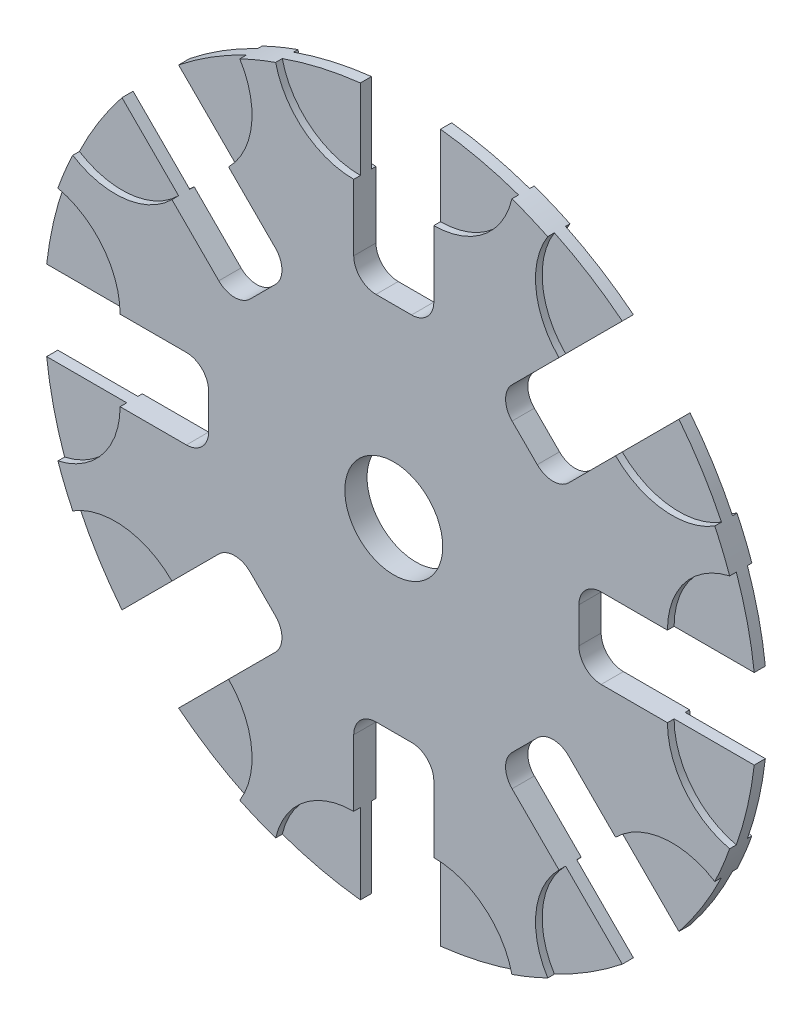
from build123d import *

# Parameters (mm, degrees)
SKETCH1_R           = 11
BOSS_EXTRUDE1_DEPTH = 5
BOSS_EXTRUDE2_START = -4
BOSS_EXTRUDE2_DEPTH = 2.5


with BuildPart() as part:
    # Sketch1 → Boss-Extrude1 (new body)
    with BuildSketch(Plane.XY):
        with BuildLine():
            ThreePointArc((4, -41.6), (7.535533906, -43.064466094), (9, -46.6))
            Line((9, -46.6), (9, -61.492137976))
            ThreePointArc((9, -61.492137976), (20.215230476, -65.413125036), (26.544375, -75.467848491))
            ThreePointArc((26.544375, -75.467848491), (30.614674589, -73.910362601), (34.594119865, -72.133534994))
            ThreePointArc((34.594119865, -72.133534994), (31.959737739, -60.548390845), (37.117546722, -49.845468783))
            Line((37.117546722, -49.845468783), (26.587214973, -39.315137034))
            ThreePointArc((26.587214973, -39.315137034), (25.122748879, -35.779603128), (26.587214973, -32.244069222))
            Line((26.587214973, -32.244069222), (32.244069222, -26.587214973))
            ThreePointArc((32.244069222, -26.587214973), (35.779603128, -25.122748879), (39.315137034, -26.587214973))
            Line((39.315137034, -26.587214973), (49.845468783, -37.117546722))
            ThreePointArc((49.845468783, -37.117546722), (60.548390845, -31.959737739), (72.133534994, -34.594119865))
            ThreePointArc((72.133534994, -34.594119865), (73.910362601, -30.614674589), (75.467848491, -26.544375))
            ThreePointArc((75.467848491, -26.544375), (65.413125036, -20.215230476), (61.492137976, -9))
            Line((61.492137976, -9), (46.6, -9))
            ThreePointArc((46.6, -9), (43.064466094, -7.535533906), (41.6, -4))
            Line((41.6, -4), (41.6, 4))
            ThreePointArc((41.6, 4), (43.064466094, 7.535533906), (46.6, 9))
            Line((46.6, 9), (61.492137976, 9))
            ThreePointArc((61.492137976, 9), (65.413125036, 20.215230476), (75.467848491, 26.544375))
            ThreePointArc((75.467848491, 26.544375), (73.910362601, 30.614674589), (72.133534994, 34.594119865))
            ThreePointArc((72.133534994, 34.594119865), (60.548390845, 31.959737739), (49.845468783, 37.117546722))
            Line((49.845468783, 37.117546722), (39.315137034, 26.587214973))
            ThreePointArc((39.315137034, 26.587214973), (35.779603128, 25.122748879), (32.244069222, 26.587214973))
            Line((32.244069222, 26.587214973), (26.587214973, 32.244069222))
            ThreePointArc((26.587214973, 32.244069222), (25.122748879, 35.779603128), (26.587214973, 39.315137034))
            Line((26.587214973, 39.315137034), (37.117546722, 49.845468783))
            ThreePointArc((37.117546722, 49.845468783), (31.959737739, 60.548390845), (34.594119865, 72.133534994))
            ThreePointArc((34.594119865, 72.133534994), (30.614674589, 73.910362601), (26.544375, 75.467848491))
            ThreePointArc((26.544375, 75.467848491), (20.215230476, 65.413125036), (9, 61.492137976))
            Line((9, 61.492137976), (9, 46.6))
            ThreePointArc((9, 46.6), (7.535533906, 43.064466094), (4, 41.6))
            Line((4, 41.6), (-4, 41.6))
            ThreePointArc((-4, 41.6), (-7.535533906, 43.064466094), (-9, 46.6))
            Line((-9, 46.6), (-9, 61.492137976))
            ThreePointArc((-9, 61.492137976), (-20.215230476, 65.413125036), (-26.544375, 75.467848491))
            ThreePointArc((-26.544375, 75.467848491), (-30.614674589, 73.910362601), (-34.594119865, 72.133534994))
            ThreePointArc((-34.594119865, 72.133534994), (-31.959737739, 60.548390845), (-37.117546722, 49.845468783))
            Line((-37.117546722, 49.845468783), (-26.587214973, 39.315137034))
            ThreePointArc((-26.587214973, 39.315137034), (-25.122748879, 35.779603128), (-26.587214973, 32.244069222))
            Line((-26.587214973, 32.244069222), (-32.244069222, 26.587214973))
            ThreePointArc((-32.244069222, 26.587214973), (-35.779603128, 25.122748879), (-39.315137034, 26.587214973))
            Line((-39.315137034, 26.587214973), (-49.845468783, 37.117546722))
            ThreePointArc((-49.845468783, 37.117546722), (-60.548390845, 31.959737739), (-72.133534994, 34.594119865))
            ThreePointArc((-72.133534994, 34.594119865), (-73.910362601, 30.614674589), (-75.467848491, 26.544375))
            ThreePointArc((-75.467848491, 26.544375), (-65.413125036, 20.215230476), (-61.492137976, 9))
            Line((-61.492137976, 9), (-46.6, 9))
            ThreePointArc((-46.6, 9), (-43.064466094, 7.535533906), (-41.6, 4))
            Line((-41.6, 4), (-41.6, -4))
            ThreePointArc((-41.6, -4), (-43.064466094, -7.535533906), (-46.6, -9))
            Line((-46.6, -9), (-61.492137976, -9))
            ThreePointArc((-61.492137976, -9), (-65.413125036, -20.215230476), (-75.467848491, -26.544375))
            ThreePointArc((-75.467848491, -26.544375), (-73.910362601, -30.614674589), (-72.133534994, -34.594119865))
            ThreePointArc((-72.133534994, -34.594119865), (-60.548390845, -31.959737739), (-49.845468783, -37.117546722))
            Line((-49.845468783, -37.117546722), (-39.315137034, -26.587214973))
            ThreePointArc((-39.315137034, -26.587214973), (-35.779603128, -25.122748879), (-32.244069222, -26.587214973))
            Line((-32.244069222, -26.587214973), (-26.587214973, -32.244069222))
            ThreePointArc((-26.587214973, -32.244069222), (-25.122748879, -35.779603128), (-26.587214973, -39.315137034))
            Line((-26.587214973, -39.315137034), (-37.117546722, -49.845468783))
            ThreePointArc((-37.117546722, -49.845468783), (-31.959737739, -60.548390845), (-34.594119865, -72.133534994))
            ThreePointArc((-34.594119865, -72.133534994), (-30.614674589, -73.910362601), (-26.544375, -75.467848491))
            ThreePointArc((-26.544375, -75.467848491), (-20.215230476, -65.413125036), (-9, -61.492137976))
            Line((-9, -61.492137976), (-9, -46.6))
            ThreePointArc((-9, -46.6), (-7.535533906, -43.064466094), (-4, -41.6))
            Line((-4, -41.6), (4, -41.6))
        make_face()
        Circle(SKETCH1_R, mode=Mode.SUBTRACT)
    extrude(amount=BOSS_EXTRUDE1_DEPTH)

    # Sketch2 → Boss-Extrude2 (add)
    with BuildSketch(Plane.XY.offset(5).offset(BOSS_EXTRUDE2_START)):
        with BuildLine():
            ThreePointArc((-37.117546722, 49.845468783), (-31.959737739, 60.548390845), (-34.594119865, 72.133534994))
            ThreePointArc((-34.594119865, 72.133534994), (-42.489529555, 67.783772971), (-49.845468783, 62.573390845))
            Line((-49.845468783, 62.573390845), (-37.117546722, 49.845468783))
        make_face()
        with BuildLine():
            Line((-49.845468783, 37.117546722), (-62.573390845, 49.845468783))
            ThreePointArc((-62.573390845, 49.845468783), (-67.783772971, 42.489529555), (-72.133534994, 34.594119865))
            ThreePointArc((-72.133534994, 34.594119865), (-60.548390845, 31.959737739), (-49.845468783, 37.117546722))
        make_face()
        with BuildLine():
            Line((-9, 61.492137976), (-9, 79.492137976))
            ThreePointArc((-9, 79.492137976), (-17.885731045, 77.975), (-26.544375, 75.467848491))
            ThreePointArc((-26.544375, 75.467848491), (-20.215230476, 65.413125036), (-9, 61.492137976))
        make_face()
        with BuildLine():
            ThreePointArc((9, 61.492137976), (20.215230476, 65.413125036), (26.544375, 75.467848491))
            ThreePointArc((26.544375, 75.467848491), (17.885731045, 77.975), (9, 79.492137976))
            Line((9, 79.492137976), (9, 61.492137976))
        make_face()
        with BuildLine():
            Line((37.117546722, 49.845468783), (49.845468783, 62.573390845))
            ThreePointArc((49.845468783, 62.573390845), (42.489529555, 67.783772971), (34.594119865, 72.133534994))
            ThreePointArc((34.594119865, 72.133534994), (31.959737739, 60.548390845), (37.117546722, 49.845468783))
        make_face()
        with BuildLine():
            ThreePointArc((49.845468783, 37.117546722), (60.548390845, 31.959737739), (72.133534994, 34.594119865))
            ThreePointArc((72.133534994, 34.594119865), (67.783772971, 42.489529555), (62.573390845, 49.845468783))
            Line((62.573390845, 49.845468783), (49.845468783, 37.117546722))
        make_face()
        with BuildLine():
            Line((61.492137976, 9), (79.492137976, 9))
            ThreePointArc((79.492137976, 9), (77.975, 17.885731045), (75.467848491, 26.544375))
            ThreePointArc((75.467848491, 26.544375), (65.413125036, 20.215230476), (61.492137976, 9))
        make_face()
        with BuildLine():
            Line((79.492137976, -9), (61.492137976, -9))
            ThreePointArc((61.492137976, -9), (65.413125036, -20.215230476), (75.467848491, -26.544375))
            ThreePointArc((75.467848491, -26.544375), (77.975, -17.885731045), (79.492137976, -9))
        make_face()
        with BuildLine():
            ThreePointArc((62.573390845, -49.845468783), (67.783772971, -42.489529555), (72.133534994, -34.594119865))
            ThreePointArc((72.133534994, -34.594119865), (60.548390845, -31.959737739), (49.845468783, -37.117546722))
            Line((49.845468783, -37.117546722), (62.573390845, -49.845468783))
        make_face()
        with BuildLine():
            ThreePointArc((34.594119865, -72.133534994), (42.489529555, -67.783772971), (49.845468783, -62.573390845))
            Line((49.845468783, -62.573390845), (37.117546722, -49.845468783))
            ThreePointArc((37.117546722, -49.845468783), (31.959737739, -60.548390845), (34.594119865, -72.133534994))
        make_face()
        with BuildLine():
            ThreePointArc((9, -79.492137976), (17.885731045, -77.975), (26.544375, -75.467848491))
            ThreePointArc((26.544375, -75.467848491), (20.215230476, -65.413125036), (9, -61.492137976))
            Line((9, -61.492137976), (9, -79.492137976))
        make_face()
        with BuildLine():
            ThreePointArc((-26.544375, -75.467848491), (-17.885731045, -77.975), (-9, -79.492137976))
            Line((-9, -79.492137976), (-9, -61.492137976))
            ThreePointArc((-9, -61.492137976), (-20.215230476, -65.413125036), (-26.544375, -75.467848491))
        make_face()
        with BuildLine():
            ThreePointArc((-49.845468783, -62.573390845), (-42.489529555, -67.783772971), (-34.594119865, -72.133534994))
            ThreePointArc((-34.594119865, -72.133534994), (-31.959737739, -60.548390845), (-37.117546722, -49.845468783))
            Line((-37.117546722, -49.845468783), (-49.845468783, -62.573390845))
        make_face()
        with BuildLine():
            ThreePointArc((-72.133534994, -34.594119865), (-67.783772971, -42.489529555), (-62.573390845, -49.845468783))
            Line((-62.573390845, -49.845468783), (-49.845468783, -37.117546722))
            ThreePointArc((-49.845468783, -37.117546722), (-60.548390845, -31.959737739), (-72.133534994, -34.594119865))
        make_face()
        with BuildLine():
            ThreePointArc((-79.492137976, -9), (-77.975, -17.885731045), (-75.467848491, -26.544375))
            ThreePointArc((-75.467848491, -26.544375), (-65.413125036, -20.215230476), (-61.492137976, -9))
            Line((-61.492137976, -9), (-79.492137976, -9))
        make_face()
        with BuildLine():
            ThreePointArc((-75.467848491, 26.544375), (-77.975, 17.885731045), (-79.492137976, 9))
            Line((-79.492137976, 9), (-61.492137976, 9))
            ThreePointArc((-61.492137976, 9), (-65.413125036, 20.215230476), (-75.467848491, 26.544375))
        make_face()
    extrude(amount=BOSS_EXTRUDE2_DEPTH)


solid = part.part
